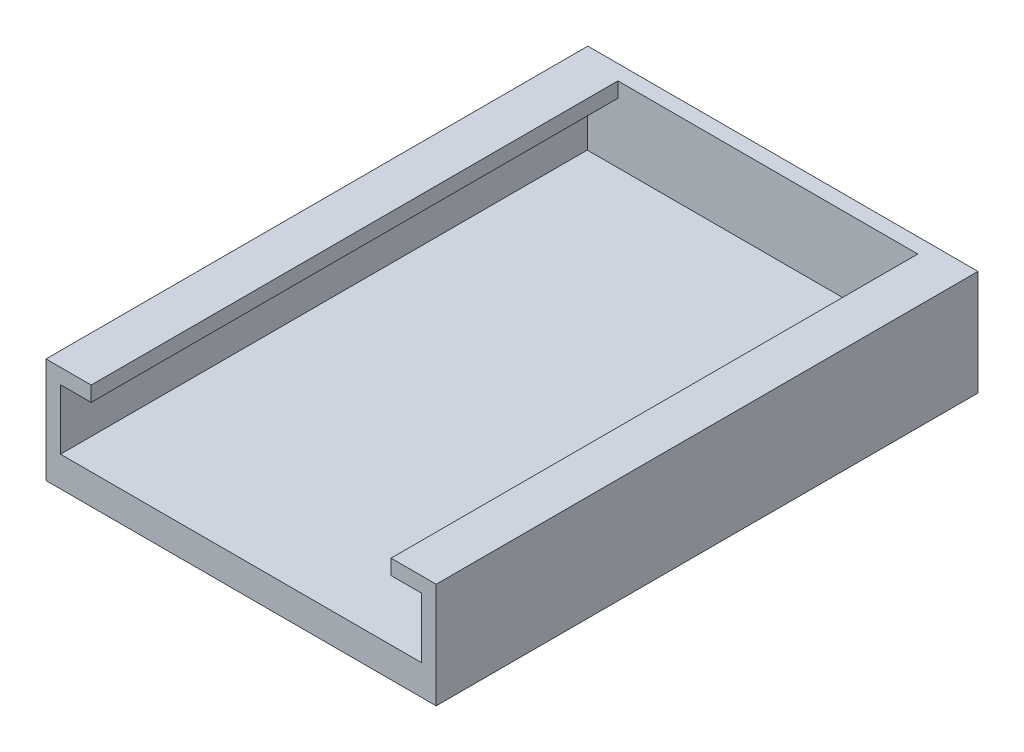
from build123d import *

# Parameters (mm, degrees)
EXTRUDE_2_DEPTH = 35
SKETCH_3_W      = 25.925675676
SKETCH_3_H      = 7
EXTRUDE_3_DEPTH = 1


with BuildPart() as part:
    # 草图2 → 凸台-拉伸2 (new body)
    with BuildSketch(Plane.XY):
        Polygon((-10, 0), (10, 0), (12.962837838, 0), (12.962837838, 7), (9.962837838, 7), (9.962837838, 6), (12, 6), (12, 2), (10, 2), (-10, 2), (-12, 2), (-12, 6), (-9.962837838, 6), (-9.962837838, 7), (-12.962837838, 7), (-12.962837838, 0), align=None)
    extrude(amount=EXTRUDE_2_DEPTH)

    # 草图3 → 凸台-拉伸3 (add)
    with BuildSketch(Plane(origin=(0, 0, 0), x_dir=(-1, 0, 0), z_dir=(0, 0, -1))):
        with Locations((0, 3.5)):
            Rectangle(SKETCH_3_W, SKETCH_3_H)
    extrude(amount=EXTRUDE_3_DEPTH)


solid = part.part
